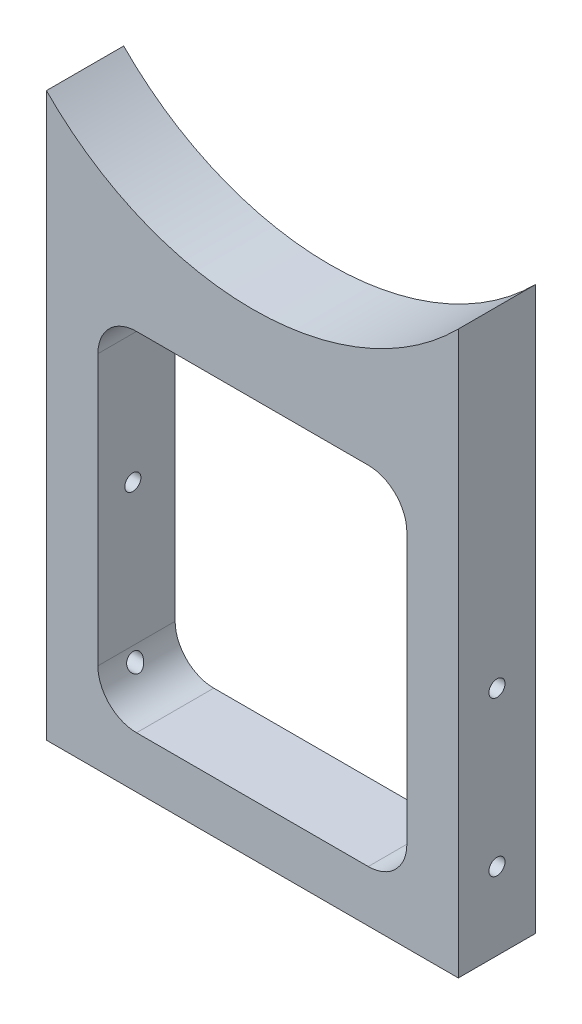
from build123d import *

# Parameters (mm, degrees)
BOSS_EXTRU_1_DEPTH      = 6
ESQUISSE3_R             = 0.625
ENL_V_MAT_EXTRU_4_DEPTH = 6
ESQUISSE4_R             = 0.625
ENL_V_MAT_EXTRU_5_DEPTH = 6


with BuildPart() as part:
    # Esquisse1 → Boss.-Extru.1 (new body)
    with BuildSketch(Plane.XY):
        with BuildLine():
            Line((-16, 25.2), (-16, -18.5))
            Line((-16, -18.5), (16, -18.5))
            Line((16, -18.5), (16, 25.161446269))
            ThreePointArc((16, 25.161446269), (-0.008048953, 18.500008258), (-16, 25.2))
        make_face()
        with BuildLine():
            ThreePointArc((-9, -14.5), (-11.121320344, -13.621320344), (-12, -11.5))
            Line((-12, -11.5), (-12, 9.5))
            ThreePointArc((-12, 9.5), (-11.121320344, 11.621320344), (-9, 12.5))
            Line((-9, 12.5), (9, 12.5))
            ThreePointArc((9, 12.5), (11.121320344, 11.621320344), (12, 9.5))
            Line((12, 9.5), (12, -11.5))
            ThreePointArc((12, -11.5), (11.121320344, -13.621320344), (9, -14.5))
            Line((9, -14.5), (-9, -14.5))
        make_face(mode=Mode.SUBTRACT)
    extrude(amount=BOSS_EXTRU_1_DEPTH)

    # Esquisse3 → Enlèv. mat.-Extru.4 (cut)
    with BuildSketch(Plane(origin=(16, 0, 0), x_dir=(0, 0, -1), z_dir=(1, 0, 0))):
        with Locations(Location((-3, -0.5, 0), (0, 0, 90))):
            Circle(ESQUISSE3_R)
        with Locations(Location((-3, -12.5, 0), (0, 0, 90))):
            Circle(ESQUISSE3_R)
    extrude(amount=-ENL_V_MAT_EXTRU_4_DEPTH, mode=Mode.SUBTRACT)

    # Esquisse4 → Enlèv. mat.-Extru.5 (cut)
    with BuildSketch(Plane.ZY.offset(16)):
        with Locations((3.284775488, -12.5)):
            Circle(ESQUISSE4_R)
        with Locations((3.284775488, -0.5)):
            Circle(ESQUISSE4_R)
    extrude(amount=-ENL_V_MAT_EXTRU_5_DEPTH, mode=Mode.SUBTRACT)


solid = part.part
